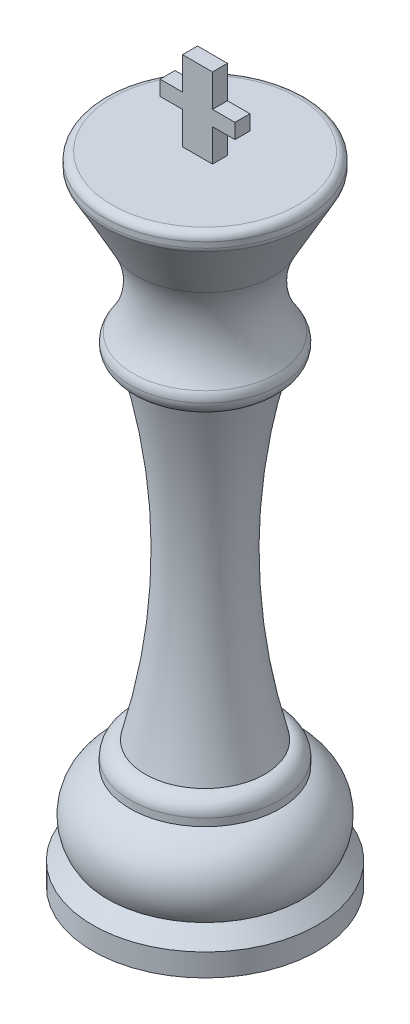
from build123d import *

# Parameters (mm, degrees)
FILLET1_R           = 1
BOSS_EXTRUDE1_DEPTH = 1


with BuildPart() as part:
    # Sketch1 → Revolve1 (revolve)
    with BuildSketch(Plane.XY, mode=Mode.PRIVATE) as revolve1_sk:
        with BuildLine():
            Line((0, 0), (-15, 0))
            Line((-15, 0), (-15, 3))
            Line((-15, 3), (-13, 5))
            ThreePointArc((-13, 5), (-13.688325627, 10.216881481), (-10, 13.97))
            Line((-10, 13.97), (-10, 14.97))
            ThreePointArc((-10, 14.97), (-9.414213562, 16.384213562), (-8, 16.97))
            ThreePointArc((-8, 16.97), (-5.100912906, 38.98), (-8, 60.99))
            ThreePointArc((-8, 60.99), (-9.414213562, 61.575786438), (-10, 62.99))
            ThreePointArc((-10, 62.99), (-9.903920807, 63.59955414), (-9.625, 64.15))
            ThreePointArc((-9.625, 64.15), (-7.718956652, 69.516640804), (-9, 75.065763501))
            Line((-9, 75.065763501), (-13.303871601, 82.839750191))
            ThreePointArc((-13.303871601, 82.839750191), (-13.397211325, 83.07397526), (-13.428998168, 83.324101795))
            Line((-13.428998168, 83.324101795), (-13.428998168, 85.065763501))
            Line((-13.428998168, 85.065763501), (0, 85.065763501))
            Line((0, 85.065763501), (0, 0))
        make_face()
    revolve(revolve1_sk.sketch.rotate(Axis((0, 0, 0), (0, 1, 0)), 270), axis=Axis((0, 0, 0), (0, 1, 0)))

    # Fillet1
    fillet1_edges = [part.edges().sort_by_distance(p)[0] for p in [
        (0, 85.065763501, 13.428998168),
    ]]
    fillet(fillet1_edges, radius=FILLET1_R)

    # Sketch2 → Boss-Extrude1 (add, symmetric)
    with BuildSketch(Plane.XY):
        Polygon((-2.008998168, 85.065763501), (1.991001832, 85.065763501), (1.991001832, 89.402035395), (4.991001832, 89.402035395), (4.991001832, 91.402035395), (1.991001832, 91.402035395), (1.991001832, 95.738307289), (-2.008998168, 95.738307289), (-2.008998168, 91.402035395), (-5.008998168, 91.402035395), (-5.008998168, 89.402035395), (-2.008998168, 89.402035395), align=None)
    extrude(amount=BOSS_EXTRUDE1_DEPTH, both=True)


solid = part.part
